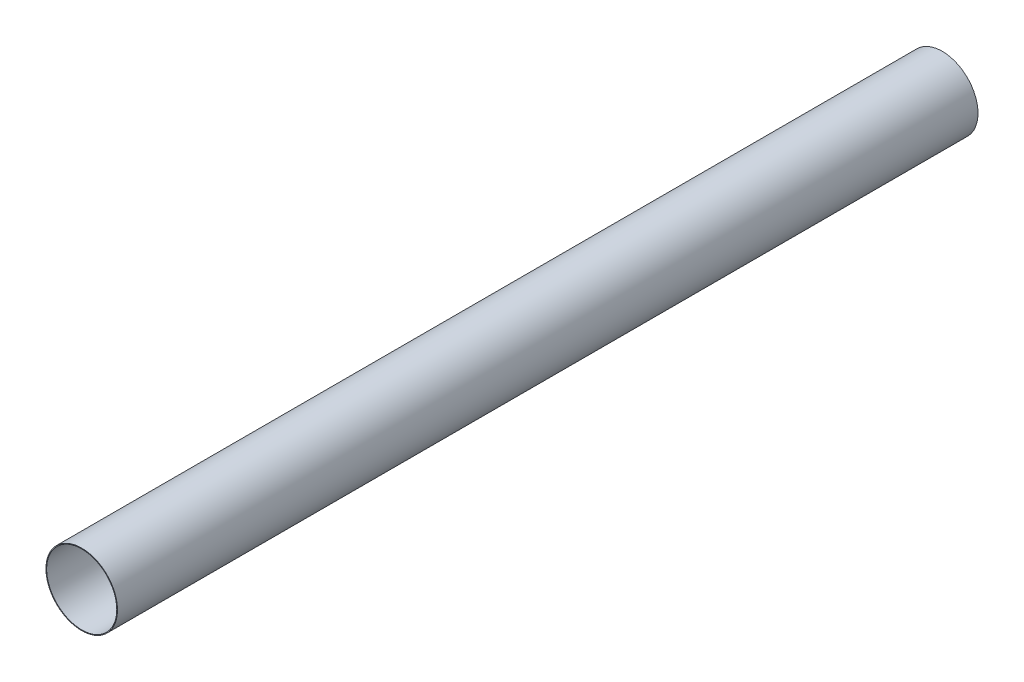
from build123d import *

# Parameters (mm, degrees)
SKETCH1_R           = 75
SKETCH1_R_2         = 73.5
BOSS_EXTRUDE1_DEPTH = 1804


with BuildPart() as part:
    # Sketch1 → Boss-Extrude1 (new body)
    with BuildSketch(Plane.XY):
        Circle(SKETCH1_R)
        Circle(SKETCH1_R_2, mode=Mode.SUBTRACT)
    extrude(amount=BOSS_EXTRUDE1_DEPTH)


solid = part.part
